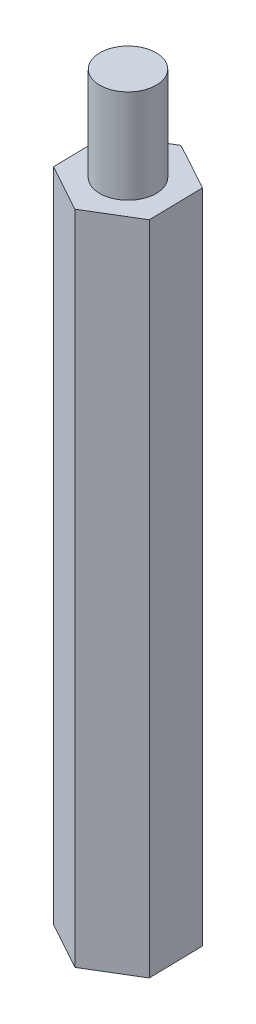
from build123d import *

# Parameters (mm, degrees)
EXTRUDE_1_DEPTH     = 35
SKETCH_2_R          = 1.5
CUT_EXTRUDE_1_DEPTH = 5
SKETCH_3_R          = 1.5
EXTRUDE_2_DEPTH     = 5


with BuildPart() as part:
    # 草图1 → 凸台-拉伸1 (new body)
    with BuildSketch(Plane(origin=(0, 0, 0), x_dir=(1, 0, 0), z_dir=(0, 1, 0))):
        Polygon((2.528327266, -1.393159922), (2.470675517, 1.49301568), (-0.057651749, 2.886175603), (-2.528327266, 1.393159922), (-2.470675517, -1.49301568), (0.057651749, -2.886175603), align=None)
    extrude(amount=EXTRUDE_1_DEPTH)

    # 草图2 → 切除-拉伸1 (cut)
    with BuildSketch(Plane.XZ):
        with Locations(Location((0, 0, 0), (0, 0, 270))):
            Circle(SKETCH_2_R)
    extrude(amount=-CUT_EXTRUDE_1_DEPTH, mode=Mode.SUBTRACT)

    # 草图3 → 凸台-拉伸2 (add)
    with BuildSketch(Plane(origin=(0, 35, 0), x_dir=(1, 0, 0), z_dir=(0, 1, 0))):
        with Locations(Location((0, 0, 0), (0, 0, 90))):
            Circle(SKETCH_3_R)
    extrude(amount=EXTRUDE_2_DEPTH)


solid = part.part
